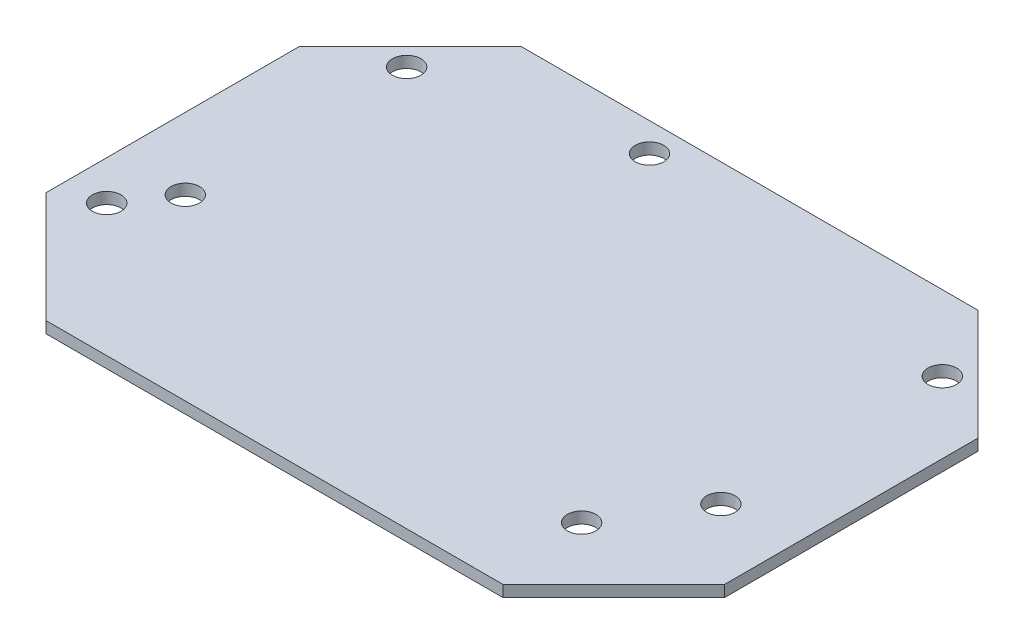
from build123d import *

# Parameters (mm, degrees)
BOSS_EXTRUDE1_DEPTH = 1.6
SKETCH2_R           = 2
CUT_EXTRUDE1_DEPTH  = 116.973315896
CUT_EXTRUDE2_REACH  = 117.973
SKETCH3_R           = 2


with BuildPart() as part:
    # Sketch1 → Boss-Extrude1 (new body)
    with BuildSketch(Plane(origin=(0, 0, 0), x_dir=(1, 0, 0), z_dir=(0, 1, 0))):
        Polygon((0, 15.5), (15.5, 0), (79.5, 0), (95, 15.5), (95, 51), (79.5, 66.5), (15.5, 66.5), (0, 51), align=None)
    extrude(amount=BOSS_EXTRUDE1_DEPTH)

    # Sketch2 → Cut-Extrude1 (cut, through all)
    with BuildSketch(Plane(origin=(0, 1.6, 0), x_dir=(1, 0, 0), z_dir=(0, 1, 0))):
        with Locations(Location((5.5, 18.5, 0), (0, 0, 270))):
            Circle(SKETCH2_R)
        with Locations(Location((77.5, 13, 0), (0, 0, 270))):
            Circle(SKETCH2_R)
        with Locations(Location((37.5, 62.5, 0), (0, 0, 270))):
            Circle(SKETCH2_R)
    extrude(amount=-CUT_EXTRUDE1_DEPTH, mode=Mode.SUBTRACT)

    # Sketch3 → Cut-Extrude2 (cut, up to next)
    with BuildSketch(Plane(origin=(0, 1.6, 0), x_dir=(1, 0, 0), z_dir=(0, 1, 0)), mode=Mode.PRIVATE) as cut_extrude2_sk1:
        with Locations(Location((10, 56, 0), (0, 0, 270))):
            Circle(SKETCH3_R)
    cut_extrude2_tool1 = extrude(cut_extrude2_sk1.sketch, amount=-CUT_EXTRUDE2_REACH, mode=Mode.PRIVATE) & part.part
    # Sketch3 → Cut-Extrude2 (cut, up to next)
    with BuildSketch(Plane(origin=(0, 1.6, 0), x_dir=(1, 0, 0), z_dir=(0, 1, 0)), mode=Mode.PRIVATE) as cut_extrude2_sk2:
        with Locations(Location((85, 56, 0), (0, 0, 270))):
            Circle(SKETCH3_R)
    cut_extrude2_tool2 = extrude(cut_extrude2_sk2.sketch, amount=-CUT_EXTRUDE2_REACH, mode=Mode.PRIVATE) & part.part
    # Sketch3 → Cut-Extrude2 (cut, up to next)
    with BuildSketch(Plane(origin=(0, 1.6, 0), x_dir=(1, 0, 0), z_dir=(0, 1, 0)), mode=Mode.PRIVATE) as cut_extrude2_sk3:
        with Locations(Location((85, 25, 0), (0, 0, 270))):
            Circle(SKETCH3_R)
    cut_extrude2_tool3 = extrude(cut_extrude2_sk3.sketch, amount=-CUT_EXTRUDE2_REACH, mode=Mode.PRIVATE) & part.part
    # Sketch3 → Cut-Extrude2 (cut, up to next)
    with BuildSketch(Plane(origin=(0, 1.6, 0), x_dir=(1, 0, 0), z_dir=(0, 1, 0)), mode=Mode.PRIVATE) as cut_extrude2_sk4:
        with Locations(Location((10, 25, 0), (0, 0, 270))):
            Circle(SKETCH3_R)
    cut_extrude2_tool4 = extrude(cut_extrude2_sk4.sketch, amount=-CUT_EXTRUDE2_REACH, mode=Mode.PRIVATE) & part.part
    add(cut_extrude2_tool1.solids().sort_by_distance((10, 1.6, -56))[0], mode=Mode.SUBTRACT)
    add(cut_extrude2_tool2.solids().sort_by_distance((85, 1.6, -56))[0], mode=Mode.SUBTRACT)
    add(cut_extrude2_tool3.solids().sort_by_distance((85, 1.6, -25))[0], mode=Mode.SUBTRACT)
    add(cut_extrude2_tool4.solids().sort_by_distance((10, 1.6, -25))[0], mode=Mode.SUBTRACT)


solid = part.part
